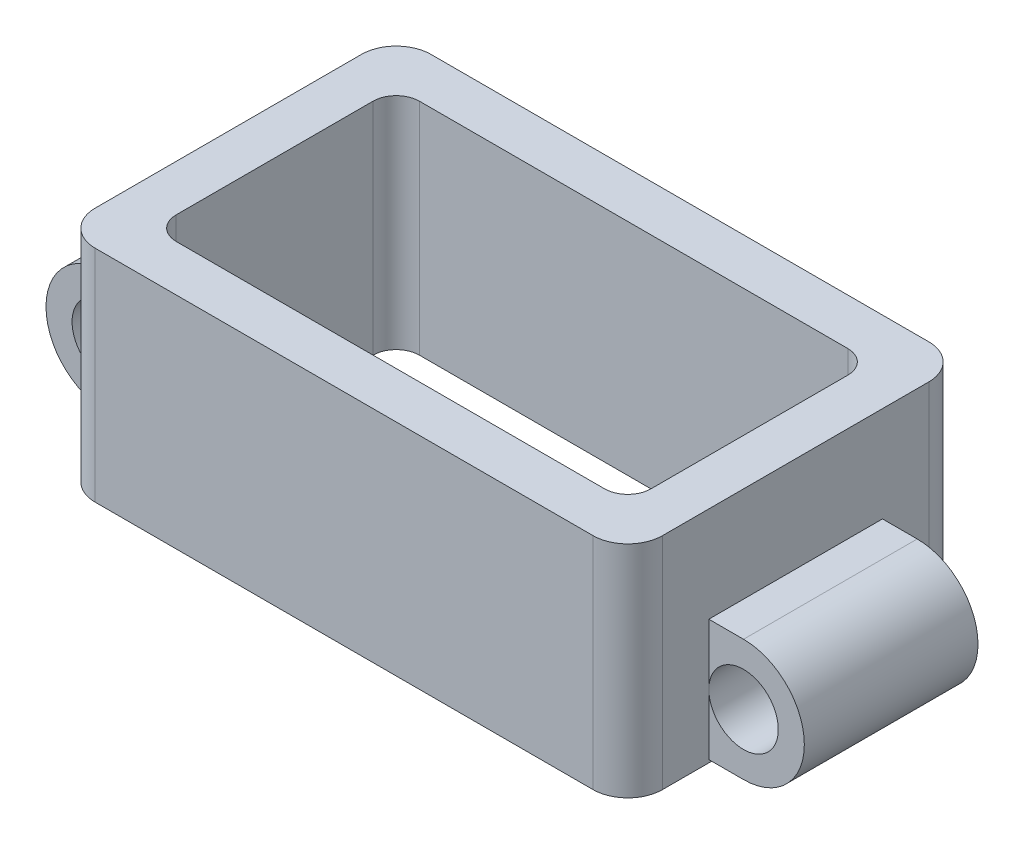
from build123d import *

# Parameters (mm, degrees)
ESQUISSE1_W             = 49
ESQUISSE1_H             = 29
ESQUISSE1_W_2           = 41
ESQUISSE1_H_2           = 21
BOSS_EXTRU_1_DEPTH      = 19
CONG_1_R                = 3
CONG_2_R                = 2
ESQUISSE2_W             = 15
ESQUISSE2_H             = 10.5
BOSS_EXTRU_2_DEPTH      = 19
ESQUISSE3_W             = 15
ESQUISSE3_H             = 10.5
BOSS_EXTRU_3_DEPTH      = 19
ENL_V_MAT_EXTRU_1_REACH = 83.444
ESQUISSE5_R             = 3
ENL_V_MAT_EXTRU_2_REACH = 83.444
ENL_V_MAT_EXTRU_3_REACH = 73.505
ESQUISSE8_R             = 3
ENL_V_MAT_EXTRU_4_REACH = 73.505


with BuildPart() as part:
    # Esquisse1 → Boss.-Extru.1 (new body)
    with BuildSketch(Plane(origin=(0, 0, 0), x_dir=(1, 0, 0), z_dir=(0, 1, 0))):
        with Locations((-32.579514124, -18.656539988)):
            Rectangle(ESQUISSE1_W, ESQUISSE1_H)
        with Locations((-32.579514124, -18.656539988)):
            Rectangle(ESQUISSE1_W_2, ESQUISSE1_H_2, mode=Mode.SUBTRACT)
    extrude(amount=BOSS_EXTRU_1_DEPTH)

    # Congé1
    cong_1_edges = [part.edges().sort_by_distance(p)[0] for p in [
        (-57.079514124, 9.5, 4.156539988),
        (-8.079514124, 9.5, 4.156539988),
        (-8.079514124, 9.5, 33.156539988),
        (-57.079514124, 9.5, 33.156539988),
    ]]
    fillet(cong_1_edges, radius=CONG_1_R)

    # Congé2
    cong_2_edges = [part.edges().sort_by_distance(p)[0] for p in [
        (-53.079514124, 9.5, 8.156539988),
        (-53.079514124, 9.5, 29.156539988),
        (-12.079514124, 9.5, 29.156539988),
        (-12.079514124, 9.5, 8.156539988),
    ]]
    fillet(cong_2_edges, radius=CONG_2_R)

    # Esquisse2 → Boss.-Extru.2 (add)
    with BuildSketch(Plane(origin=(-8.079514124, 0, 0), x_dir=(0, 0, -1), z_dir=(1, 0, 0))):
        with Locations((-18.656539988, 5.5)):
            Rectangle(ESQUISSE2_W, ESQUISSE2_H)
    extrude(amount=BOSS_EXTRU_2_DEPTH)

    # Esquisse3 → Boss.-Extru.3 (add)
    with BuildSketch(Plane.ZY.offset(57.079514124)):
        with Locations((18.656539988, 5.5)):
            Rectangle(ESQUISSE3_W, ESQUISSE3_H)
    extrude(amount=BOSS_EXTRU_3_DEPTH)

    # Esquisse5 → Enlèv. mat.-Extru.1 (cut, up to next)
    with BuildSketch(Plane(origin=(0, 0, 11.156539988), x_dir=(-1, 0, 0), z_dir=(0, 0, -1)), mode=Mode.PRIVATE) as enl_v_mat_extru_1_sk1:
        with Locations(Location((60.079514124, 5.5, 0), (0, 0, 180))):
            Circle(ESQUISSE5_R)
    enl_v_mat_extru_1_tool1 = extrude(enl_v_mat_extru_1_sk1.sketch, amount=-ENL_V_MAT_EXTRU_1_REACH, mode=Mode.PRIVATE) & part.part
    add(enl_v_mat_extru_1_tool1.solids().sort_by_distance((-60.079514, 5.5, 11.15654))[0], mode=Mode.SUBTRACT)

    # Esquisse7 → Enlèv. mat.-Extru.2 (cut, up to next)
    with BuildSketch(Plane(origin=(0, 0, 11.156539988), x_dir=(-1, 0, 0), z_dir=(0, 0, -1)), mode=Mode.PRIVATE) as enl_v_mat_extru_2_sk1:
        with BuildLine():
            Line((60.079514124, 0.25), (76.079514124, 0.25))
            Line((76.079514124, 0.25), (76.079514124, 10.75))
            Line((76.079514124, 10.75), (60.079514124, 10.75))
            ThreePointArc((60.079514124, 10.75), (65.329514124, 5.5), (60.079514124, 0.25))
        make_face()
    enl_v_mat_extru_2_tool1 = extrude(enl_v_mat_extru_2_sk1.sketch, amount=-ENL_V_MAT_EXTRU_2_REACH, mode=Mode.PRIVATE) & part.part
    add(enl_v_mat_extru_2_tool1.solids().sort_by_distance((-70.083379, 5.5, 11.15654))[0], mode=Mode.SUBTRACT)

    # Esquisse8 → Enlèv. mat.-Extru.3 (cut, up to next)
    with BuildSketch(Plane(origin=(0, 0, 11.156539988), x_dir=(-1, 0, 0), z_dir=(0, 0, -1)), mode=Mode.PRIVATE) as enl_v_mat_extru_3_sk1:
        with Locations((5.079514124, 5.5)):
            Circle(ESQUISSE8_R)
    enl_v_mat_extru_3_tool1 = extrude(enl_v_mat_extru_3_sk1.sketch, amount=-ENL_V_MAT_EXTRU_3_REACH, mode=Mode.PRIVATE) & part.part
    add(enl_v_mat_extru_3_tool1.solids().sort_by_distance((-5.079514, 5.5, 11.15654))[0], mode=Mode.SUBTRACT)

    # Esquisse9 → Enlèv. mat.-Extru.4 (cut, up to next)
    with BuildSketch(Plane(origin=(0, 0, 11.156539988), x_dir=(-1, 0, 0), z_dir=(0, 0, -1)), mode=Mode.PRIVATE) as enl_v_mat_extru_4_sk1:
        with BuildLine():
            Line((5.079514124, 0.25), (-10.920485876, 0.25))
            Line((-10.920485876, 0.25), (-10.920485876, 10.75))
            Line((-10.920485876, 10.75), (5.079514124, 10.75))
            ThreePointArc((5.079514124, 10.75), (-0.170485876, 5.5), (5.079514124, 0.25))
        make_face()
    enl_v_mat_extru_4_tool1 = extrude(enl_v_mat_extru_4_sk1.sketch, amount=-ENL_V_MAT_EXTRU_4_REACH, mode=Mode.PRIVATE) & part.part
    add(enl_v_mat_extru_4_tool1.solids().sort_by_distance((4.924351, 5.5, 11.15654))[0], mode=Mode.SUBTRACT)


solid = part.part
